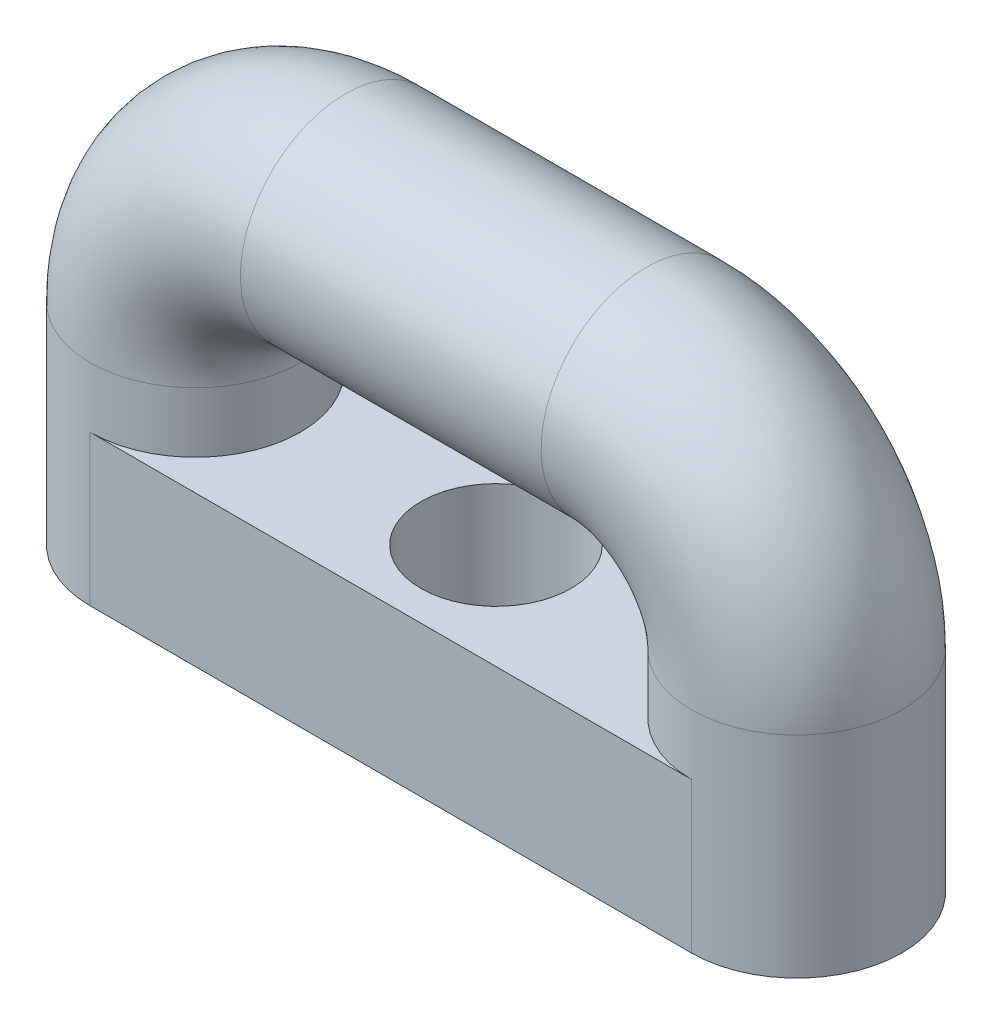
from build123d import *
from build123d.topology import SkipClean

# Parameters (mm, degrees)
BOSS_EXTRUDE1_DEPTH = 6.35
SWEEP1_PROFILE_R    = 4.445
SKETCH11_R          = 3.175
CUT_EXTRUDE1_DEPTH  = 23.170504775


with BuildPart() as part:
    # Sketch1 → Boss-Extrude1 (new body)
    with BuildSketch(Plane(origin=(0, 0, 0), x_dir=(1, 0, 0), z_dir=(0, 1, 0))):
        with BuildLine():
            Line((-12.7, -4.445), (12.7, -4.445))
            ThreePointArc((12.7, -4.445), (17.145, 0), (12.7, 4.445))
            Line((12.7, 4.445), (-12.7, 4.445))
            ThreePointArc((-12.7, 4.445), (-17.145, 0), (-12.7, -4.445))
        make_face()
    extrude(amount=BOSS_EXTRUDE1_DEPTH)

    # Sweep1: sweep along a path in Sketch3
    with SkipClean():  # the faces are left unmerged after this step: merging them gives an invalid solid
        with BuildLine(Plane.XY) as sweep1_path:
            Line((-12.7, 6.35), (-12.7, 8.89))
            ThreePointArc((-12.7, 8.89), (-10.840128061, 13.380128061), (-6.35, 15.24))
            Line((-6.35, 15.24), (6.35, 15.24))
            ThreePointArc((6.35, 15.24), (10.840128061, 13.380128061), (12.7, 8.89))
            Line((12.7, 8.89), (12.7, 6.35))
        # Sweep1 profile (on start of the path) → Sweep1 (sweep)
        with BuildSketch(Plane(origin=(-12.7, 6.35, 0), x_dir=(0, 0, 1), z_dir=(0, 1, 0))):
            Circle(SWEEP1_PROFILE_R)
        sweep(path=sweep1_path.line)

    # Sketch11 → Cut-Extrude1 (cut, through all)
    with SkipClean():  # the faces are left unmerged after this step: merging them gives an invalid solid
        with BuildSketch(Plane(origin=(0, 6.35, 0), x_dir=(1, 0, 0), z_dir=(0, 1, 0))):
            Circle(SKETCH11_R)
        extrude(amount=-CUT_EXTRUDE1_DEPTH, mode=Mode.SUBTRACT)


solid = part.part
